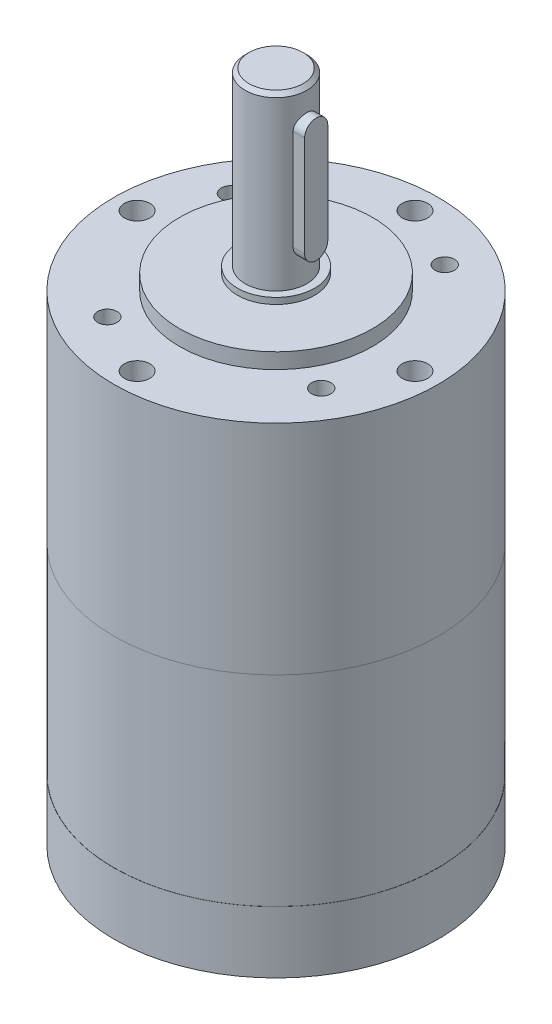
from build123d import *

# Parameters (mm, degrees)
CUT_EXTRUDE_START           = 2.2
CUT_EXTRUDE_1_DEPTH         = 90.965950871
CHAMFER_1_SIZE              = 0.5
EXTRUDE_1_DEPTH             = 3
HOLE_WIZARD_M3_1_AT_2_COUNT = 2
HOLE_WIZARD_M3_1_AT_2_PITCH = 22.627416998
HOLE_WIZARD_M3_1_AT_3_COUNT = 2
HOLE_WIZARD_M3_1_AT_3_PITCH = 22.627416998
HOLE_WIZARD_M3_1_AT_4_COUNT = 2
HOLE_WIZARD_M3_1_AT_4_PITCH = 32
HOLE_WIZARD_M4_1_AT_2_COUNT = 2
HOLE_WIZARD_M4_1_AT_2_PITCH = 25.455844123
HOLE_WIZARD_M4_1_AT_3_COUNT = 2
HOLE_WIZARD_M4_1_AT_3_PITCH = 36
HOLE_WIZARD_M4_1_AT_4_COUNT = 2
HOLE_WIZARD_M4_1_AT_4_PITCH = 25.455844123


with BuildPart() as part:
    # 草图1 → 旋转1 (revolve)
    with BuildSketch(Plane.XY, mode=Mode.PRIVATE) as revolve_1_sk:
        Polygon((4, 87.25), (0, 87.25), (0, 0), (21, 0), (21, 8), (20.98, 8), (20.98, 34), (21, 34), (21, 62.25), (12.5, 62.25), (12.5, 64.25), (5, 64.25), (5, 65.05), (4, 65.05), align=None)
    revolve(revolve_1_sk.sketch.rotate(Axis((0, 99.847112311, 0), (0, -1, 0)), 90), axis=Axis((0, 99.847112311, 0), (0, -1, 0)))

    # 草图2 → 切除-拉伸1 (cut, through all)
    with BuildSketch(Plane(origin=(0, 0, 0), x_dir=(0, 0, -1), z_dir=(1, 0, 0)).offset(CUT_EXTRUDE_START)):
        with BuildLine():
            Line((-1.5, 69.75), (-1.5, 82.75))
            ThreePointArc((-1.5, 82.75), (0, 84.25), (1.5, 82.75))
            Line((1.5, 82.75), (1.5, 69.75))
            ThreePointArc((1.5, 69.75), (0, 68.25), (-1.5, 69.75))
        make_face()
    extrude(amount=CUT_EXTRUDE_1_DEPTH, mode=Mode.SUBTRACT)

    # 倒角1
    chamfer_1_edges = [part.edges().sort_by_distance(p)[0] for p in [
        (0, 87.25, -4),
    ]]
    chamfer(chamfer_1_edges, length=CHAMFER_1_SIZE)

    # 草图6 → M3 螺纹孔1 (revolve, cut)
    with BuildSketch(Plane(origin=(13.856406461, 62.25, 8), x_dir=(0, 0, 1), z_dir=(1, 0, 0))):
        Polygon((0, 0), (0, 10.751075774), (1.25, 10), (1.25, 0), align=None)
    hole_wizard_m3_1 = revolve(axis=Axis((13.856406461, 68.6, 8), (0, -1, 0)), mode=Mode.SUBTRACT)

    # M3 螺纹孔1 at 2: M3 螺纹孔1 ×2
    with Locations(*[Vector(-0.25881904510252673, 0, -0.9659258262890666) * (i * HOLE_WIZARD_M3_1_AT_2_PITCH) for i in range(1, HOLE_WIZARD_M3_1_AT_2_COUNT)]):
        add(hole_wizard_m3_1, mode=Mode.SUBTRACT)

    # M3 螺纹孔1 at 3: M3 螺纹孔1 ×2
    with Locations(*[Vector(-0.9659258262890666, 0, 0.25881904510252673) * (i * HOLE_WIZARD_M3_1_AT_3_PITCH) for i in range(1, HOLE_WIZARD_M3_1_AT_3_COUNT)]):
        add(hole_wizard_m3_1, mode=Mode.SUBTRACT)

    # M3 螺纹孔1 at 4: M3 螺纹孔1 ×2
    with Locations(*[Vector(-0.8660254037844418, 0, -0.4999999999999946) * (i * HOLE_WIZARD_M3_1_AT_4_PITCH) for i in range(1, HOLE_WIZARD_M3_1_AT_4_COUNT)]):
        add(hole_wizard_m3_1, mode=Mode.SUBTRACT)

    # 草图8 → M4 螺纹孔1 (revolve, cut)
    with BuildSketch(Plane(origin=(18, 62.25, 0), x_dir=(0, 0, 1), z_dir=(1, 0, 0))):
        Polygon((0, 0), (0, 10.991420021), (1.65, 10), (1.65, 0), align=None)
    hole_wizard_m4_1 = revolve(axis=Axis((18, 68.6, 0), (0, -1, 0)), mode=Mode.SUBTRACT)

    # M4 螺纹孔1 at 2: M4 螺纹孔1 ×2
    with Locations(*[Vector(-0.7071067811865476, 0, 0.7071067811865476) * (i * HOLE_WIZARD_M4_1_AT_2_PITCH) for i in range(1, HOLE_WIZARD_M4_1_AT_2_COUNT)]):
        add(hole_wizard_m4_1, mode=Mode.SUBTRACT)

    # M4 螺纹孔1 at 3: M4 螺纹孔1 ×2
    with Locations(*[(-i * HOLE_WIZARD_M4_1_AT_3_PITCH, 0, 0) for i in range(1, HOLE_WIZARD_M4_1_AT_3_COUNT)]):
        add(hole_wizard_m4_1, mode=Mode.SUBTRACT)

    # M4 螺纹孔1 at 4: M4 螺纹孔1 ×2
    with Locations(*[Vector(-0.7071067811865476, 0, -0.7071067811865476) * (i * HOLE_WIZARD_M4_1_AT_4_PITCH) for i in range(1, HOLE_WIZARD_M4_1_AT_4_COUNT)]):
        add(hole_wizard_m4_1, mode=Mode.SUBTRACT)


with BuildPart() as body_2:
    # 草图3 → 凸台-拉伸1 (new body)
    with BuildSketch(Plane(origin=(2.2, 0, 0), x_dir=(0, 0, -1), z_dir=(1, 0, 0))):
        with BuildLine():
            Line((1.5, 69.75), (1.5, 82.75))
            ThreePointArc((1.5, 82.75), (0, 84.25), (-1.5, 82.75))
            Line((-1.5, 82.75), (-1.5, 69.75))
            ThreePointArc((-1.5, 69.75), (0, 68.25), (1.5, 69.75))
        make_face()
    extrude(amount=EXTRUDE_1_DEPTH)


solid = Compound([part.part, body_2.part])
